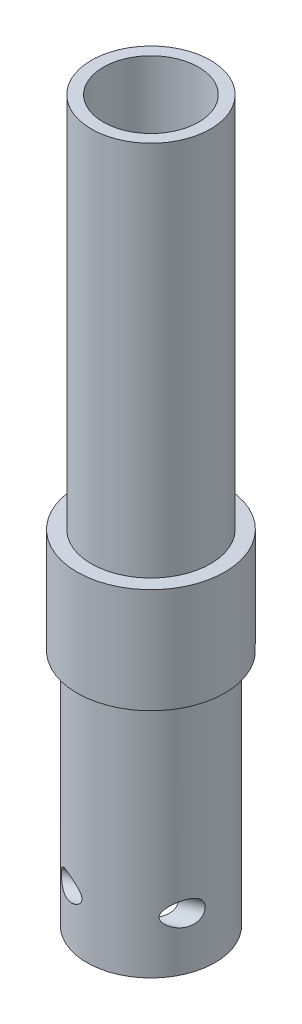
from build123d import *
from build123d.topology import SkipClean

# Parameters (mm, degrees)
SKETCH1_R                = 13.45
SKETCH1_R_2              = 10
BOSS_EXTRUDE1_DEPTH      = 100
BOSS_EXTRUDE2_DEPTH      = 85
BOSS_EXTRUDE2_DEPTH_BACK = 4
SKETCH6_R                = 12.5
SKETCH6_R_2              = 10
BOSS_EXTRUDE3_START      = -84
SKETCH7_R                = 15.5
SKETCH7_R_2              = 10
BOSS_EXTRUDE3_DEPTH      = 1
CUT_EXTRUDE1_DEPTH       = 187.294122291
CUT_EXTRUDE1_DEPTH_BACK  = 187.294122291
SKETCH11_W               = 35.010034018
SKETCH11_H               = 2.4
CUT_EXTRUDE3_DEPTH       = 187.294122291
CUT_EXTRUDE3_DEPTH_BACK  = 187.294122291
SKETCH13_W               = 32.559051685
SKETCH13_H               = 42.8
SKETCH14_R               = 15.5
BOSS_EXTRUDE4_DEPTH      = 21
SKETCH15_R               = 10
CUT_EXTRUDE4_DEPTH       = 22
BOSS_EXTRUDE5_START      = 10
SKETCH17_R               = 13.45
SKETCH17_R_2             = 10
BOSS_EXTRUDE5_DEPTH      = 10
SKETCH18_R               = 2.5
CUT_EXTRUDE5_DEPTH       = 54
SKETCH20_R               = 2
CUT_EXTRUDE6_DEPTH       = 22


with BuildPart() as part:
    # Sketch1 → Boss-Extrude1 (new body)
    with BuildSketch(Plane(origin=(0, 0, 0), x_dir=(1, 0, 0), z_dir=(0, 1, 0))):
        with Locations(Location((0, 0, 0), (0, 0, 270))):
            Circle(SKETCH1_R)
        with Locations(Location((0, 0, 0), (0, 0, 270))):
            Circle(SKETCH1_R_2, mode=Mode.SUBTRACT)
    extrude(amount=BOSS_EXTRUDE1_DEPTH)

    # Sketch6 → Boss-Extrude2 (add, two sides: drawn at the far end of the back side and taken through both)
    with BuildSketch(Plane(origin=(0, 100, 0), x_dir=(1, 0, 0), z_dir=(0, 1, 0)).offset(-BOSS_EXTRUDE2_DEPTH_BACK)):
        with Locations(Location((0, 0, 0), (0, 0, 270))):
            Circle(SKETCH6_R)
        with Locations(Location((0, 0, 0), (0, 0, 270))):
            Circle(SKETCH6_R_2, mode=Mode.SUBTRACT)
    extrude(amount=BOSS_EXTRUDE2_DEPTH + BOSS_EXTRUDE2_DEPTH_BACK)

    # Sketch7 → Boss-Extrude3 (add)
    with BuildSketch(Plane.XZ.offset(BOSS_EXTRUDE3_START)):
        with Locations(Location((0, 0, 0), (0, 0, 270))):
            Circle(SKETCH7_R)
        with Locations(Location((0, 0, 0), (0, 0, 90))):
            Circle(SKETCH7_R_2, mode=Mode.SUBTRACT)
    extrude(amount=-BOSS_EXTRUDE3_DEPTH)

    # Sketch11 → Cut-Extrude1 (cut, two sides: drawn at the far end of the back side and taken through both)
    with BuildSketch(Plane(origin=(0, 0, 0), x_dir=(0, 0, -1), z_dir=(1, 0, 0)).offset(-CUT_EXTRUDE1_DEPTH_BACK)):
        Rectangle(SKETCH11_W, SKETCH11_H)
    extrude(amount=CUT_EXTRUDE1_DEPTH + CUT_EXTRUDE1_DEPTH_BACK, mode=Mode.SUBTRACT)

    # Sketch13 → Cut-Extrude3 (cut, two sides: drawn at the far end of the back side and taken through both)
    with BuildSketch(Plane.XY.offset(-CUT_EXTRUDE3_DEPTH_BACK)):
        with Locations((2.829525842, 22.6)):
            Rectangle(SKETCH13_W, SKETCH13_H)
    extrude(amount=CUT_EXTRUDE3_DEPTH + CUT_EXTRUDE3_DEPTH_BACK, mode=Mode.SUBTRACT)

    # Sketch14 → Boss-Extrude4 (add)
    with BuildSketch(Plane(origin=(0, 85, 0), x_dir=(1, 0, 0), z_dir=(0, 1, 0))):
        with Locations(Location((0, 0, 0), (0, 0, 270))):
            Circle(SKETCH14_R)
    extrude(amount=BOSS_EXTRUDE4_DEPTH)

    # Sketch15 → Cut-Extrude4 (cut)
    with BuildSketch(Plane.XZ.offset(-85)):
        with Locations(Location((0, 0, 0), (0, 0, 90))):
            Circle(SKETCH15_R)
    extrude(amount=-CUT_EXTRUDE4_DEPTH, mode=Mode.SUBTRACT)

    # Sketch17 → Boss-Extrude5 (add)
    with BuildSketch(Plane.XZ.offset(-44).offset(BOSS_EXTRUDE5_START)):
        with Locations(Location((0, 0, 0), (0, 0, 270))):
            Circle(SKETCH17_R)
        with Locations(Location((0, 0, 0), (0, 0, 270))):
            Circle(SKETCH17_R_2, mode=Mode.SUBTRACT)
    extrude(amount=-BOSS_EXTRUDE5_DEPTH)

    # Sketch18 → Cut-Extrude5 (cut)
    with SkipClean():  # the faces are left unmerged after this step: merging them gives an invalid solid
        with BuildSketch(Plane(origin=(35.019010809, 0, -14.753605728), x_dir=(-0.38825278231327914, 1.212401304802914e-15, -0.9215529160205601), z_dir=(0.9215529160205602, -2.877743595734803e-15, -0.3882527823132792))):
            with Locations((-9.45, 45)):
                Circle(SKETCH18_R)
        extrude(amount=-CUT_EXTRUDE5_DEPTH, mode=Mode.SUBTRACT)

    # Sketch20 → Cut-Extrude6 (cut)
    with BuildSketch(Plane.XY):
        with Locations(Location((0, 71.5, 0), (0, 0, 90))):
            Circle(SKETCH20_R)
    extrude(amount=-CUT_EXTRUDE6_DEPTH, mode=Mode.SUBTRACT)


solid = part.part
